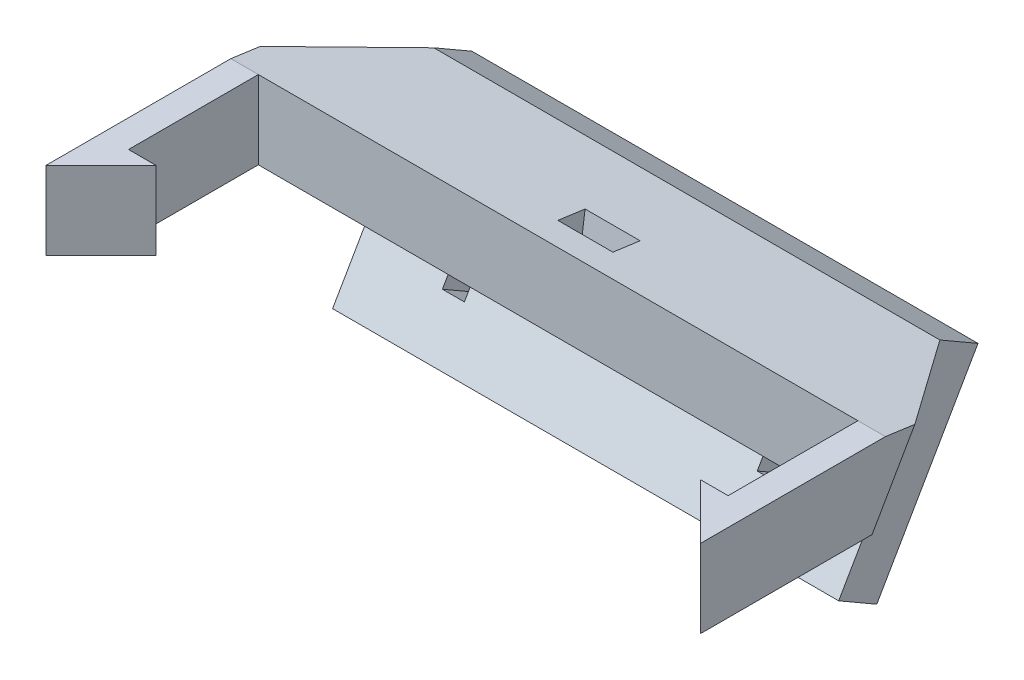
from build123d import *

# Parameters (mm, degrees)
SKETCH1_W                      = 75.565
SKETCH1_H                      = 35.56
BOSS_EXTRUDE1_DEPTH            = 3.175
SKETCH5_W                      = 12.7
SKETCH5_H                      = 3.175
BOSS_EXTRUDE3_DEPTH            = 14.986
SKETCH6_W                      = 3.175
SKETCH6_H                      = 9.028368652
BOSS_EXTRUDE4_DEPTH            = 14.986
BOSS_EXTRUDE5_DEPTH            = 12.7
BOSS_EXTRUDE6_DEPTH            = 9.028368652
BOSS_EXTRUDE7_DEPTH            = 75.565
SKETCH10_W                     = 75.565
SKETCH10_H                     = 23.368
BOSS_EXTRUDE8_DEPTH            = 5.08
CUT_EXTRUDE1_DEPTH             = 82.106081899
CUT_EXTRUDE2_REACH             = 52.218
SKETCH12_W                     = 6.35
SKETCH12_H                     = 3.175
CUT_EXTRUDE2_DIRECTION_2_DEPTH = 51.217629864
CUT_EXTRUDE3_DEPTH             = 55.104465738
CUT_EXTRUDE4_REACH             = 55.629
SKETCH14_W                     = 2.54
SKETCH14_H                     = 3.81


with BuildPart() as part:
    # Sketch1 → Boss-Extrude1 (new body)
    with BuildSketch(Plane.XY):
        Rectangle(SKETCH1_W, SKETCH1_H)
    extrude(amount=-BOSS_EXTRUDE1_DEPTH)

    # Sketch5 → Boss-Extrude3 (add)
    with BuildSketch(Plane.XY):
        with Locations((0, 16.1925)):
            Rectangle(SKETCH5_W, SKETCH5_H)
        with Locations((0, -16.1925)):
            Rectangle(SKETCH5_W, SKETCH5_H)
    extrude(amount=BOSS_EXTRUDE3_DEPTH)

    # Sketch6 → Boss-Extrude4 (add)
    with BuildSketch(Plane.XY):
        with Locations((-36.195, 0)):
            Rectangle(SKETCH6_W, SKETCH6_H)
        with Locations((36.195, 0)):
            Rectangle(SKETCH6_W, SKETCH6_H)
    extrude(amount=BOSS_EXTRUDE4_DEPTH)

    # Sketch7 → Boss-Extrude5 (add)
    with BuildSketch(Plane.ZY.offset(6.35)):
        Polygon((14.986, -17.78), (14.986, -11.43), (21.336, -17.78), align=None)
        Polygon((14.986, 17.78), (14.986, 11.43), (21.336, 17.78), align=None)
    extrude(amount=-BOSS_EXTRUDE5_DEPTH)

    # Sketch8 → Boss-Extrude6 (add)
    with BuildSketch(Plane.XZ.offset(4.514184326)):
        Polygon((-37.7825, 14.986), (-31.4325, 14.986), (-37.7825, 21.336), align=None)
        Polygon((37.7825, 14.986), (31.4325, 14.986), (37.7825, 21.336), align=None)
    extrude(amount=-BOSS_EXTRUDE6_DEPTH)

    # Sketch9 → Boss-Extrude7 (add)
    with BuildSketch(Plane.ZY.offset(37.7825)):
        Polygon((-3.175, 17.78), (-18.572931679, 8.89), (-3.175, -17.78), align=None)
    extrude(amount=-BOSS_EXTRUDE7_DEPTH)

    # Sketch10 → Boss-Extrude8 (add)
    with BuildSketch(Plane(origin=(0, -5.819815329, -10.08021584), x_dir=(-1, 0, 0), z_dir=(0, -0.5000000000000012, -0.866025403784438))):
        with Locations((0, -2.126431679)):
            Rectangle(SKETCH10_W, SKETCH10_H)
    extrude(amount=BOSS_EXTRUDE8_DEPTH)

    # Sketch11 → Cut-Extrude1 (cut, through all)
    with BuildSketch(Plane.ZY.offset(37.7825)):
        Polygon((-14.859, 2.457281636), (0, 4.514184326), (36.888684706, 18.275511072), (5.286071508, 25.150339228), (-30.3838484, 8.233222823), align=None)
        Polygon((-3.175, -17.78), (-8.125516688, -9.205453573), (0, -4.514184326), (40.158547499, -20.406390647), (15.599703883, -25.394905756), align=None)
    extrude(amount=-CUT_EXTRUDE1_DEPTH, mode=Mode.SUBTRACT)

    # Cut-Extrude2: up to this plane
    cut_extrude2_end = Plane(origin=(37.7825, -9.205453573, -8.125516688), z_dir=(0, 0.8660254037844387, -0.5))
    # Sketch12 → Cut-Extrude2 (cut, up to the surface)
    with BuildSketch(Plane(origin=(0, 4.429308453, -0.61314062), x_dir=(1, 0, 0), z_dir=(0, 0.9905543702216956, -0.13712052958875406)), mode=Mode.PRIVATE) as cut_extrude2_sk1:
        with Locations((0, 4.143512655)):
            Rectangle(SKETCH12_W, SKETCH12_H)
    cut_extrude2_tool1 = split(extrude(cut_extrude2_sk1.sketch, amount=-CUT_EXTRUDE2_REACH, mode=Mode.PRIVATE), bisect_by=cut_extrude2_end, keep=Keep.BOTH, mode=Mode.PRIVATE)
    add(cut_extrude2_tool1.solids().sort_by_distance((0, 3.861148, -4.717515))[0], mode=Mode.SUBTRACT)

    # Sketch12 → Cut-Extrude2 direction 2 (cut)
    with BuildSketch(Plane(origin=(0, 4.429308453, -0.61314062), x_dir=(1, 0, 0), z_dir=(0, 0.9905543702216956, -0.13712052958875406))):
        with Locations((0, 4.143512655)):
            Rectangle(SKETCH12_W, SKETCH12_H)
    extrude(amount=CUT_EXTRUDE2_DIRECTION_2_DEPTH, mode=Mode.SUBTRACT)

    # Sketch13 → Cut-Extrude3 (cut, through all)
    with BuildSketch(Plane(origin=(0, 8.277096964, -4.77878416), x_dir=(1, 0, 0), z_dir=(0, 0.866025403784438, -0.5000000000000012))):
        Polygon((-29.21, 11.639630657), (-37.7825, 0.917907837), (-37.7825, 11.639630657), (-37.7825, 16.719630657), (-29.21, 16.719630657), align=None)
        Polygon((37.7825, 0.917907837), (37.7825, 11.639630657), (37.7825, 16.719630657), (29.21, 16.719630657), (29.21, 11.639630657), align=None)
    extrude(amount=-CUT_EXTRUDE3_DEPTH, mode=Mode.SUBTRACT)

    # Sketch14 → Cut-Extrude4 (cut, up to next)
    with BuildSketch(Plane(origin=(0, -8.359815329, -14.479624891), x_dir=(-1, 0, 0), z_dir=(0, -0.5000000000000014, -0.8660254037844379)), mode=Mode.PRIVATE) as cut_extrude4_sk1:
        with Locations((-18.050542255, -5.844544168)):
            Rectangle(SKETCH14_W, SKETCH14_H)
    cut_extrude4_tool1 = extrude(cut_extrude4_sk1.sketch, amount=-CUT_EXTRUDE4_REACH, mode=Mode.PRIVATE) & part.part
    # Sketch14 → Cut-Extrude4 (cut, up to next)
    with BuildSketch(Plane(origin=(0, -8.359815329, -14.479624891), x_dir=(-1, 0, 0), z_dir=(0, -0.5000000000000014, -0.8660254037844379)), mode=Mode.PRIVATE) as cut_extrude4_sk2:
        with Locations((18.295855998, -5.844544168)):
            Rectangle(SKETCH14_W, SKETCH14_H)
    cut_extrude4_tool2 = extrude(cut_extrude4_sk2.sketch, amount=-CUT_EXTRUDE4_REACH, mode=Mode.PRIVATE) & part.part
    add(cut_extrude4_tool1.solids().sort_by_distance((18.050542, -13.421339, -11.557353))[0], mode=Mode.SUBTRACT)
    add(cut_extrude4_tool2.solids().sort_by_distance((-18.295856, -13.421339, -11.557353))[0], mode=Mode.SUBTRACT)


solid = part.part
